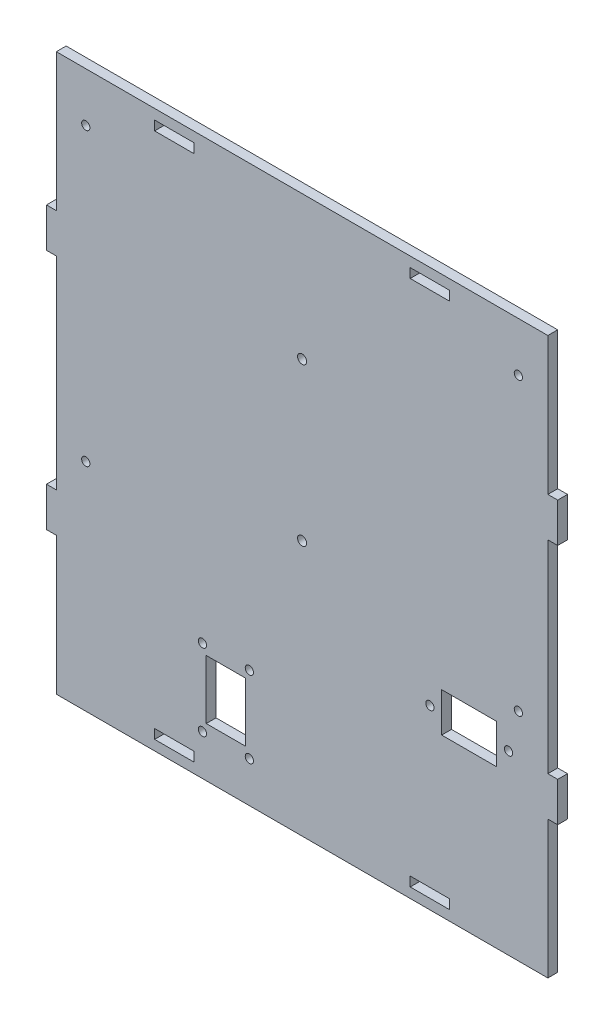
from build123d import *

# Parameters (mm, degrees)
SKETCH1_W           = 250
SKETCH1_H           = 283
SKETCH1_R           = 2.3
SKETCH1_W_2         = 20
SKETCH1_H_2         = 4.8
BOSS_EXTRUDE1_DEPTH = 5
SKETCH2_W           = 5
SKETCH2_H           = 20
BOSS_EXTRUDE2_DEPTH = 5
SKETCH3_R           = 2.1
SKETCH3_W           = 28
SKETCH3_H           = 20
CUT_EXTRUDE1_DEPTH  = 5
SKETCH4_W           = 20
SKETCH4_H           = 30
CUT_EXTRUDE2_DEPTH  = 5
SKETCH5_R           = 2.1
CUT_EXTRUDE3_DEPTH  = 378.271785322
SKETCH6_R           = 2.1
CUT_EXTRUDE4_DEPTH  = 5
SKETCH7_R           = 2.1
CUT_EXTRUDE5_DEPTH  = 5


with BuildPart() as part:
    # Sketch1 → Boss-Extrude1 (new body)
    with BuildSketch(Plane.XY):
        with Locations((125, 136.5)):
            Rectangle(SKETCH1_W, SKETCH1_H)
        with Locations((125, 125.1)):
            Circle(SKETCH1_R, mode=Mode.SUBTRACT)
        with Locations((125, 205.1)):
            Circle(SKETCH1_R, mode=Mode.SUBTRACT)
        with Locations((60, 2.5)):
            Rectangle(SKETCH1_W_2, SKETCH1_H_2, mode=Mode.SUBTRACT)
        with Locations((190, 2.5)):
            Rectangle(SKETCH1_W_2, SKETCH1_H_2, mode=Mode.SUBTRACT)
        with Locations((190, 270.5)):
            Rectangle(SKETCH1_W_2, SKETCH1_H_2, mode=Mode.SUBTRACT)
        with Locations((60, 270.5)):
            Rectangle(SKETCH1_W_2, SKETCH1_H_2, mode=Mode.SUBTRACT)
    extrude(amount=BOSS_EXTRUDE1_DEPTH)

    # Sketch2 → Boss-Extrude2 (add)
    with BuildSketch(Plane.XY.offset(5)):
        with Locations((-2.5, 198)):
            Rectangle(SKETCH2_W, SKETCH2_H)
        with Locations((-2.5, 75)):
            Rectangle(SKETCH2_W, SKETCH2_H)
        with Locations((252.5, 198)):
            Rectangle(SKETCH2_W, SKETCH2_H)
        with Locations((252.5, 75)):
            Rectangle(SKETCH2_W, SKETCH2_H)
    extrude(amount=-BOSS_EXTRUDE2_DEPTH)

    # Sketch3 → Cut-Extrude1 (cut)
    with BuildSketch(Plane.XY.offset(5)):
        with Locations((190, 85)):
            Circle(SKETCH3_R)
        with Locations((230, 85)):
            Circle(SKETCH3_R)
        with Locations((210, 85)):
            Rectangle(SKETCH3_W, SKETCH3_H)
    extrude(amount=-CUT_EXTRUDE1_DEPTH, mode=Mode.SUBTRACT)

    # Sketch4 → Cut-Extrude2 (cut)
    with BuildSketch(Plane.XY.offset(5)):
        with Locations((86.25, 35.2)):
            Rectangle(SKETCH4_W, SKETCH4_H)
    extrude(amount=-CUT_EXTRUDE2_DEPTH, mode=Mode.SUBTRACT)

    # Sketch5 → Cut-Extrude3 (cut, through all)
    with BuildSketch(Plane.XY.offset(5)):
        with Locations((98.18627451, 15.72)):
            Circle(SKETCH5_R)
        with Locations((74.31372549, 15.72)):
            Circle(SKETCH5_R)
        with Locations((74.31372549, 54.68)):
            Circle(SKETCH5_R)
        with Locations((98.18627451, 54.68)):
            Circle(SKETCH5_R)
    extrude(amount=-CUT_EXTRUDE3_DEPTH, mode=Mode.SUBTRACT)

    # Sketch6 → Cut-Extrude4 (cut)
    with BuildSketch(Plane.XY.offset(5)):
        with Locations((235, 253)):
            Circle(SKETCH6_R)
        with Locations((15, 253)):
            Circle(SKETCH6_R)
    extrude(amount=-CUT_EXTRUDE4_DEPTH, mode=Mode.SUBTRACT)

    # Sketch7 → Cut-Extrude5 (cut)
    with BuildSketch(Plane.XY.offset(5)):
        with Locations((15, 105)):
            Circle(SKETCH7_R)
        with Locations((235, 105)):
            Circle(SKETCH7_R)
    extrude(amount=-CUT_EXTRUDE5_DEPTH, mode=Mode.SUBTRACT)


solid = part.part
